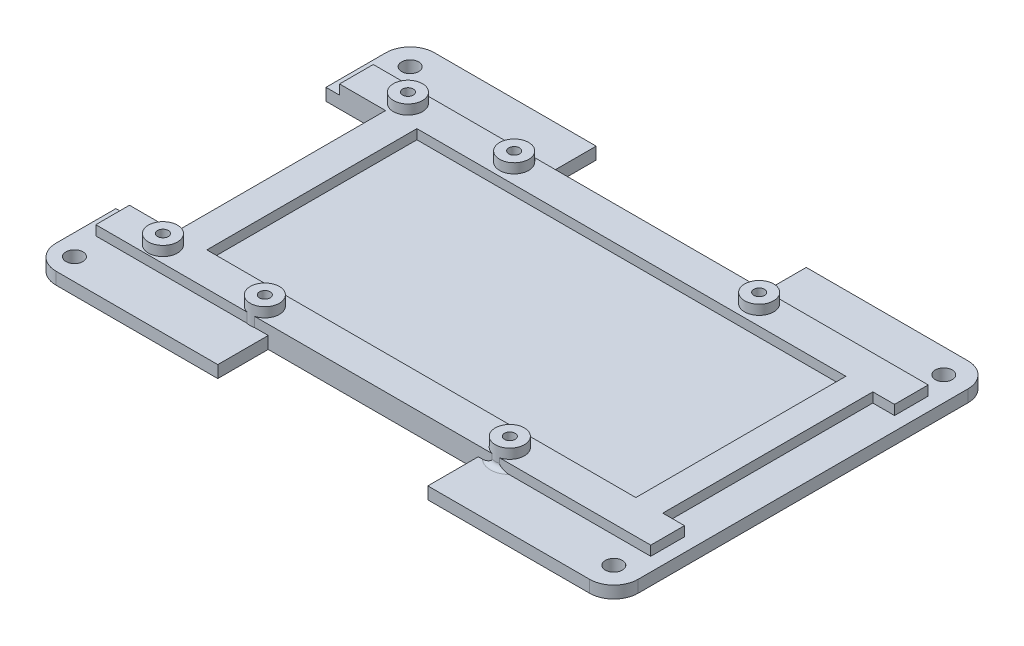
from build123d import *

# Parameters (mm, degrees)
P_IDAT_VYSUNUT_M1_DEPTH      = 2.5
SKICA2_W                     = 43.3
SKICA2_H                     = 10.4
SKICA2_W_2                   = 10.4
SKICA2_H_2                   = 43.3
ODEBRAT_VYSUNUT_M1_DEPTH     = 139.549375892
SKICA6_W                     = 120
SKICA6_H                     = 6.95
P_IDAT_VYSUNUT_M3_DEPTH      = 2
SKICA7_W                     = 5.554617132
SKICA7_H                     = 57.2
SKICA7_W_2                   = 6.443355873
P_IDAT_VYSUNUT_M4_DEPTH      = 2
SKICA3_R                     = 3
P_IDAT_VYSUNUT_M2_DEPTH      = 4
F_2_2_2_2_PR_M_R_D_RY1_D     = 2.2
F_2_2_2_2_PR_M_R_D_RY1_DEPTH = 10
ZAOBLIT1_R                   = 1
SKICA8_W                     = 2.8
SKICA8_H                     = 57.2
ODEBRAT_VYSUNUT_M3_DEPTH     = 139.58455752
F_3_5_3_5_PR_M_R_D_RY1_D     = 3.5
F_3_5_3_5_PR_M_R_D_RY1_DEPTH = 10


with BuildPart() as part:
    # Skica1 → Přidat vysunutím1 (new body)
    with BuildSketch(Plane.XZ.offset(39.4)):
        with BuildLine():
            Line((-4.318, -71.206), (-4.318, -3.206))
            ThreePointArc((-4.318, -3.206), (-2.853533906, 0.329533906), (0.682, 1.794))
            Line((0.682, 1.794), (110.682, 1.794))
            ThreePointArc((110.682, 1.794), (114.217533906, 0.329533906), (115.682, -3.206))
            Line((115.682, -3.206), (115.682, -71.206))
            ThreePointArc((115.682, -71.206), (114.217533906, -74.741533906), (110.682, -76.206))
            Line((110.682, -76.206), (0.682, -76.206))
            ThreePointArc((0.682, -76.206), (-2.853533906, -74.741533906), (-4.318, -71.206))
        make_face()
    extrude(amount=-P_IDAT_VYSUNUT_M1_DEPTH)

    # Skica2 → Odebrat vysunutím1 (cut, through all)
    with BuildSketch(Plane(origin=(0, -36.9, 0), x_dir=(1, 0, 0), z_dir=(0, 1, 0))):
        with Locations((55.682, 3.406)):
            Rectangle(SKICA2_W, SKICA2_H)
        with Locations((0.882, 37.206)):
            Rectangle(SKICA2_W_2, SKICA2_H_2)
        with Locations((55.682, 71.006)):
            Rectangle(SKICA2_W, SKICA2_H)
    extrude(amount=-ODEBRAT_VYSUNUT_M1_DEPTH, mode=Mode.SUBTRACT)

    # Skica6 → Přidat vysunutím3 (add)
    with BuildSketch(Plane(origin=(0, -36.9, 0), x_dir=(1, 0, 0), z_dir=(0, 1, 0))):
        with Locations((55.682, 12.081)):
            Rectangle(SKICA6_W, SKICA6_H)
        with Locations((55.682, 62.331)):
            Rectangle(SKICA6_W, SKICA6_H)
    extrude(amount=P_IDAT_VYSUNUT_M3_DEPTH)

    # Skica7 → Přidat vysunutím4 (add)
    with BuildSketch(Plane(origin=(0, -36.9, 0), x_dir=(1, 0, 0), z_dir=(0, 1, 0))):
        with Locations((105.633212162, 37.206)):
            Rectangle(SKICA7_W, SKICA7_H)
        with Locations((11.204720922, 37.206)):
            Rectangle(SKICA7_W_2, SKICA7_H)
    extrude(amount=P_IDAT_VYSUNUT_M4_DEPTH)

    # Skica3 → Přidat vysunutím2 (add)
    with BuildSketch(Plane(origin=(0, -36.9, 0), x_dir=(1, 0, 0), z_dir=(0, 1, 0))):
        with Locations(Location((30.432, 11.506, 0), (0, 0, 255.164888418))):
            Circle(SKICA3_R)
        with Locations(Location((8.982, 11.956, 0), (0, 0, 270))):
            Circle(SKICA3_R)
        with Locations(Location((8.982, 62.456, 0), (0, 0, 270))):
            Circle(SKICA3_R)
        with Locations(Location((30.432, 62.906, 0), (0, 0, 104.835111582))):
            Circle(SKICA3_R)
        with Locations(Location((80.932, 62.906, 0), (0, 0, 75.164888418))):
            Circle(SKICA3_R)
        with Locations(Location((80.932, 11.506, 0), (0, 0, 284.835111582))):
            Circle(SKICA3_R)
    extrude(amount=P_IDAT_VYSUNUT_M2_DEPTH)

    # Ø2.2 (2.2) průměr díry1
    with Locations(Plane(origin=(0, -39.4, 0), x_dir=(-1, 0, 0), z_dir=(0, -1, 0))):
        with Locations((-8.982, 62.456), (-30.432, 62.906), (-80.932, 62.906), (-80.932, 11.506), (-30.432, 11.506), (-8.982, 11.956)):
            Hole(F_2_2_2_2_PR_M_R_D_RY1_D / 2, depth=F_2_2_2_2_PR_M_R_D_RY1_DEPTH)

    # Zaoblit1
    zaoblit1_edges = [part.edges().sort_by_distance(p)[0] for p in [
        (80.932, -36.9, -8.506),
        (80.932, -36.9, -65.906),
        (30.432, -36.9, -65.906),
    ]]
    fillet(zaoblit1_edges, radius=ZAOBLIT1_R)

    # Skica8 → Odebrat vysunutím3 (cut, through all)
    with BuildSketch(Plane(origin=(0, -36.9, 0), x_dir=(1, 0, 0), z_dir=(0, 1, 0))):
        with Locations((-2.918, 37.206)):
            Rectangle(SKICA8_W, SKICA8_H)
        with Locations((114.282, 37.206)):
            Rectangle(SKICA8_W, SKICA8_H)
    extrude(amount=ODEBRAT_VYSUNUT_M3_DEPTH, mode=Mode.SUBTRACT)

    # Ø3.5 (3.5) průměr díry1
    with Locations(Plane(origin=(0, -39.4, 0), x_dir=(-1, 0, 0), z_dir=(0, -1, 0))):
        with Locations((0, 2.696455625), (-0.682, 71.206), (-110.682, 71.206), (-110.682, 3.206)):
            Hole(F_3_5_3_5_PR_M_R_D_RY1_D / 2, depth=F_3_5_3_5_PR_M_R_D_RY1_DEPTH)


solid = part.part
